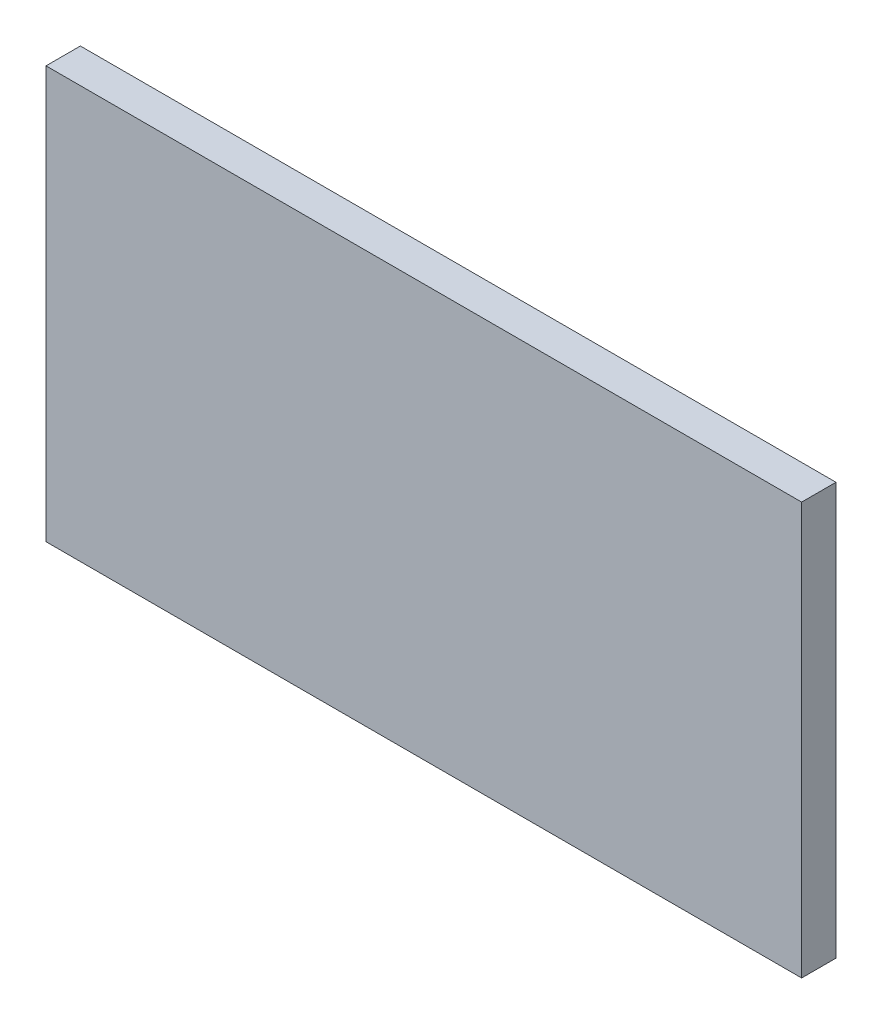
from build123d import *

# Parameters (mm, degrees)
SKETCH_1_W      = 110
SKETCH_1_H      = 60
EXTRUDE_1_DEPTH = 5


with BuildPart() as part:
    # 스케치1 → 보스-돌출1 (new body)
    with BuildSketch(Plane.XY):
        Rectangle(SKETCH_1_W, SKETCH_1_H)
    extrude(amount=EXTRUDE_1_DEPTH)


solid = part.part
